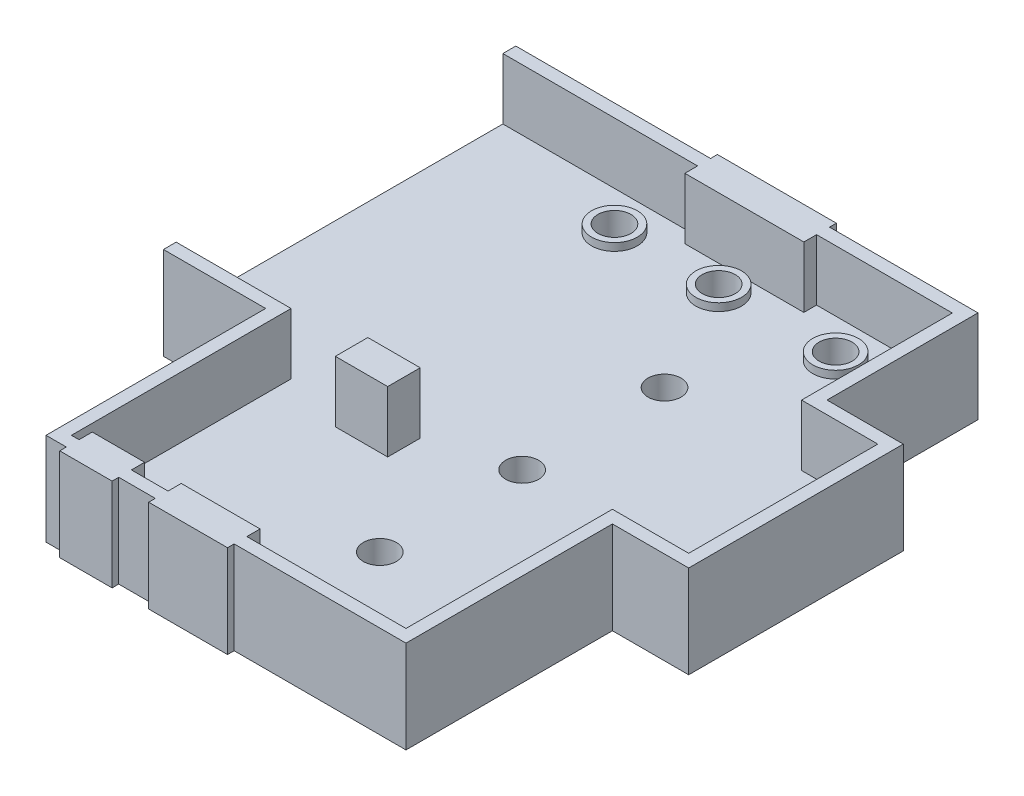
from build123d import *

# Parameters (mm, degrees)
SKETCH_1_W          = 1030
SKETCH_1_H          = 640
EXTRUDE_1_DEPTH     = 1820
EXTRUDE_2_DEPTH     = 620
SKETCH_5_R          = 450
EXTRUDE_4_DEPTH     = 770
SKETCH_6_R          = 325
CUT_EXTRUDE_1_DEPTH = 15177.989984842
SKETCH_7_R          = 325
CUT_EXTRUDE_2_DEPTH = 15189.104720471


with BuildPart() as part:
    # Эскиз1 → Бобышка-Вытянуть1 (new body)
    with BuildSketch(Plane(origin=(0, 0, 0), x_dir=(1, 0, 0), z_dir=(0, 1, 0))):
        Polygon((-8010, -10745), (-8010, -6716.192685759), (-8010, -6425), (-10270, -6425), (-10270, -6675), (-8260, -6675), (-8260, -10995), (-7860, -10995), (-7860, -11125), (-6830, -11125), (-6830, -10995), (-6110, -10995), (-6110, -11125), (-4560, -11125), (-4560, -10995), (-1180, -10995), (-1180, -6935), (320, -6935), (320, -2715), (-1180, -2715), (-1180, 255), (-4100, 255), (-4100, 390), (-6440, 390), (-6440, 255), (-10270, 255), (-10270, 0), (-6440, 0), (-6440, -250), (-4100, -250), (-4100, 0), (-1430, 0), (-1430, -2965), (70, -2965), (70, -6685), (-1430, -6685), (-1430, -10745), (-4560, -10745), (-4560, -10485), (-6110, -10485), (-6110, -10745), (-6830, -10745), (-6830, -10485), (-7860, -10485), (-7860, -10745), align=None)
        with Locations((-6245, -6485)):
            Rectangle(SKETCH_1_W, SKETCH_1_H)
    extrude(amount=EXTRUDE_1_DEPTH)

    # Эскиз3 → Бобышка-Вытянуть2 (add)
    with BuildSketch(Plane(origin=(0, 0, 0), x_dir=(1, 0, 0), z_dir=(0, 1, 0))):
        Polygon((-8260, -6675), (-10270, -6675), (-10270, 255), (-1180, 255), (-1180, -2715), (320, -2715), (320, -6935), (-1180, -6935), (-1180, -10995), (-8260, -10995), align=None)
    extrude(amount=EXTRUDE_2_DEPTH)

    # Эскиз5 → Бобышка-Вытянуть4 (add)
    with BuildSketch(Plane.XZ):
        with Locations(Location((-2970, 755, 0), (0, 0, 270))):
            Circle(SKETCH_5_R)
        with Locations(Location((-5270, 755, 0), (0, 0, 270))):
            Circle(SKETCH_5_R)
        with Locations(Location((-7320, 755, 0), (0, 0, 270))):
            Circle(SKETCH_5_R)
    extrude(amount=-EXTRUDE_4_DEPTH)

    # Эскиз6 → Вырез-Вытянуть1 (cut, through all)
    with BuildSketch(Plane(origin=(0, 770, 0), x_dir=(1, 0, 0), z_dir=(0, 1, 0))):
        with Locations(Location((-7320, -755, 0), (0, 0, 270))):
            Circle(SKETCH_6_R)
        with Locations(Location((-5270, -755, 0), (0, 0, 270))):
            Circle(SKETCH_6_R)
        with Locations(Location((-2970, -755, 0), (0, 0, 270))):
            Circle(SKETCH_6_R)
    extrude(amount=-CUT_EXTRUDE_1_DEPTH, mode=Mode.SUBTRACT)

    # Эскиз7 → Вырез-Вытянуть2 (cut, through all)
    with BuildSketch(Plane(origin=(0, 620, 0), x_dir=(1, 0, 0), z_dir=(0, 1, 0))):
        with Locations(Location((-4190, -2900, 0), (0, 0, 270))):
            Circle(SKETCH_7_R)
        with Locations(Location((-4190, -5700, 0), (0, 0, 270))):
            Circle(SKETCH_7_R)
        with Locations(Location((-4190, -8500, 0), (0, 0, 270))):
            Circle(SKETCH_7_R)
    extrude(amount=-CUT_EXTRUDE_2_DEPTH, mode=Mode.SUBTRACT)


solid = part.part
